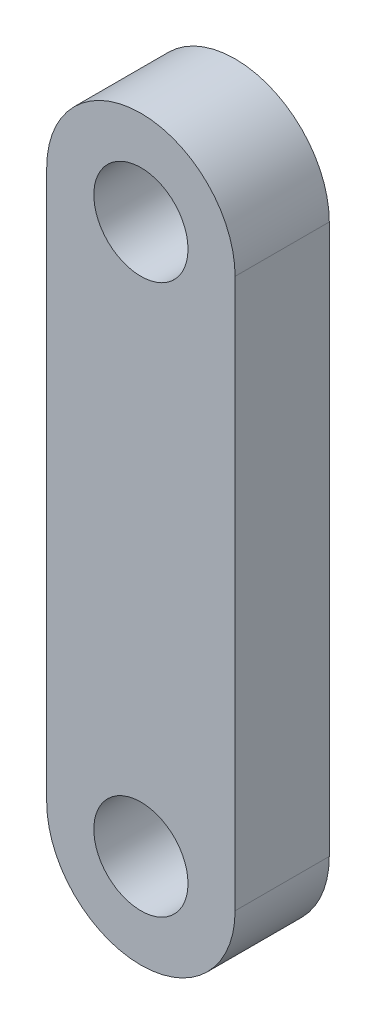
from build123d import *

# Parameters (mm, degrees)
SKETCH1_R           = 3
BOSS_EXTRUDE1_DEPTH = 6
SCALE1_SCALE        = 0.5


with BuildPart() as part:
    # Sketch1 → Boss-Extrude1 (new body)
    with BuildSketch(Plane.XY):
        with BuildLine():
            Line((6, 17.5), (6, -17.5))
            ThreePointArc((6, -17.5), (0, -23.5), (-6, -17.5))
            Line((-6, -17.5), (-6, 17.5))
            ThreePointArc((-6, 17.5), (0, 23.5), (6, 17.5))
        make_face()
        with Locations((0, 17.5)):
            Circle(SKETCH1_R, mode=Mode.SUBTRACT)
        with Locations((0, -17.5)):
            Circle(SKETCH1_R, mode=Mode.SUBTRACT)
    extrude(amount=-BOSS_EXTRUDE1_DEPTH)


with BuildPart() as part_1:
    # Scale1: scaled about (0, 0, -3)
    add(part.part.scale(SCALE1_SCALE).moved(Location((0, 0, -1.5))))


solid = part_1.part
